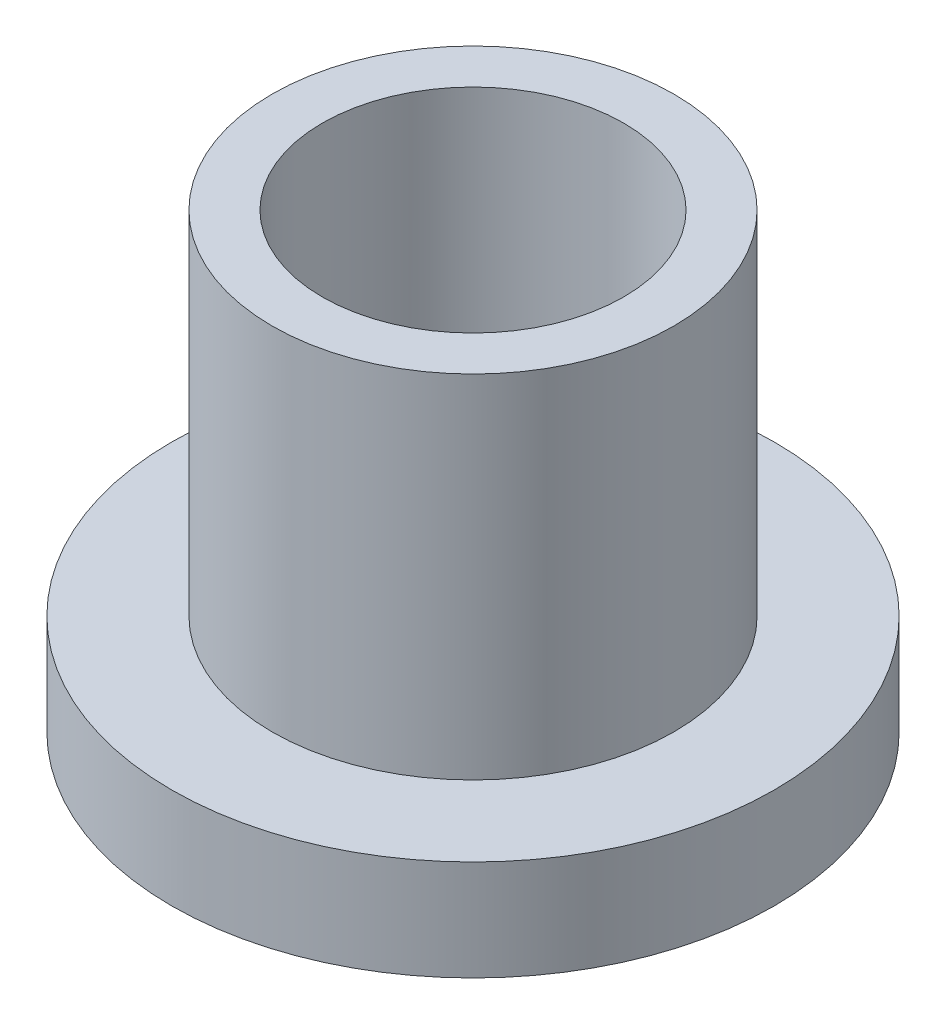
from build123d import *
from build123d.topology import SkipClean

# Parameters (mm, degrees)
CROQUIS1_R              = 4
CROQUIS1_R_2            = 3
SALIENTE_EXTRUIR1_DEPTH = 7
SALIENTE_EXTRUIR2_START = 2
CROQUIS2_R              = 6
CROQUIS2_R_2            = 3
SALIENTE_EXTRUIR2_DEPTH = 2


with BuildPart() as part:
    # Croquis1 → Saliente-Extruir1 (new body)
    with BuildSketch(Plane(origin=(0, 0, 0), x_dir=(1, 0, 0), z_dir=(0, 1, 0))):
        with Locations(Location((0, 0, 0), (0, 0, 270))):
            Circle(CROQUIS1_R)
        with Locations(Location((0, 0, 0), (0, 0, 270))):
            Circle(CROQUIS1_R_2, mode=Mode.SUBTRACT)
    extrude(amount=SALIENTE_EXTRUIR1_DEPTH)

    # Croquis2 → Saliente-Extruir2 (add)
    with SkipClean():  # the faces are left unmerged after this step: merging them gives an invalid solid
        with BuildSketch(Plane.XZ.offset(SALIENTE_EXTRUIR2_START)):
            with Locations(Location((0, 0, 0), (0, 0, 270))):
                Circle(CROQUIS2_R)
            with Locations(Location((0, 0, 0), (0, 0, 270))):
                Circle(CROQUIS2_R_2, mode=Mode.SUBTRACT)
        extrude(amount=-SALIENTE_EXTRUIR2_DEPTH)


solid = part.part
